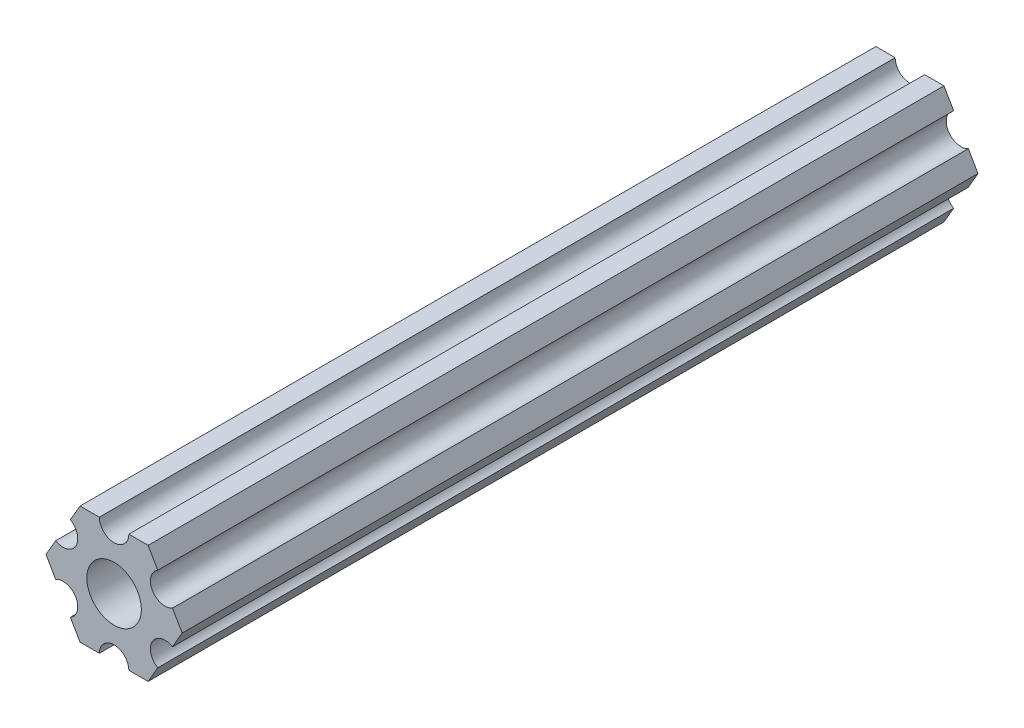
from build123d import *

# Parameters (mm, degrees)
SKETCH1_R           = 2.9337
BOSS_EXTRUDE1_DEPTH = 85.725


with BuildPart() as part:
    # Sketch1 → Boss-Extrude1 (new body)
    with BuildSketch(Plane.XY):
        with BuildLine():
            Line((3.666174176, -6.349999977), (4.705511247, -4.549815325))
            ThreePointArc((4.705511247, -4.549815325), (4.124445898, -2.381250002), (6.293011221, -1.800184653))
            Line((6.293011221, -1.800184653), (7.332348293, 0))
            Line((7.332348293, 0), (6.293011221, 1.800184653))
            ThreePointArc((6.293011221, 1.800184653), (4.124445898, 2.381250002), (4.705511247, 4.549815325))
            Line((4.705511247, 4.549815325), (3.666174176, 6.349999977))
            Line((3.666174176, 6.349999977), (1.5875, 6.349999977))
            ThreePointArc((1.5875, 6.349999977), (0, 4.762499977), (-1.5875, 6.349999977))
            Line((-1.5875, 6.349999977), (-3.666174176, 6.349999977))
            Line((-3.666174176, 6.349999977), (-4.705511247, 4.549815325))
            ThreePointArc((-4.705511247, 4.549815325), (-4.124445898, 2.381250002), (-6.293011221, 1.800184653))
            Line((-6.293011221, 1.800184653), (-7.332348293, 0))
            Line((-7.332348293, 0), (-6.293011221, -1.800184653))
            ThreePointArc((-6.293011221, -1.800184653), (-4.124445898, -2.381250002), (-4.705511247, -4.549815325))
            Line((-4.705511247, -4.549815325), (-3.666174176, -6.349999977))
            Line((-3.666174176, -6.349999977), (-1.5875, -6.349999977))
            ThreePointArc((-1.5875, -6.349999977), (0, -4.762499977), (1.5875, -6.349999977))
            Line((1.5875, -6.349999977), (3.666174176, -6.349999977))
        make_face()
        with Locations(Location((0, 0, 0), (0, 0, 180))):
            Circle(SKETCH1_R, mode=Mode.SUBTRACT)
    extrude(amount=-BOSS_EXTRUDE1_DEPTH)


solid = part.part
